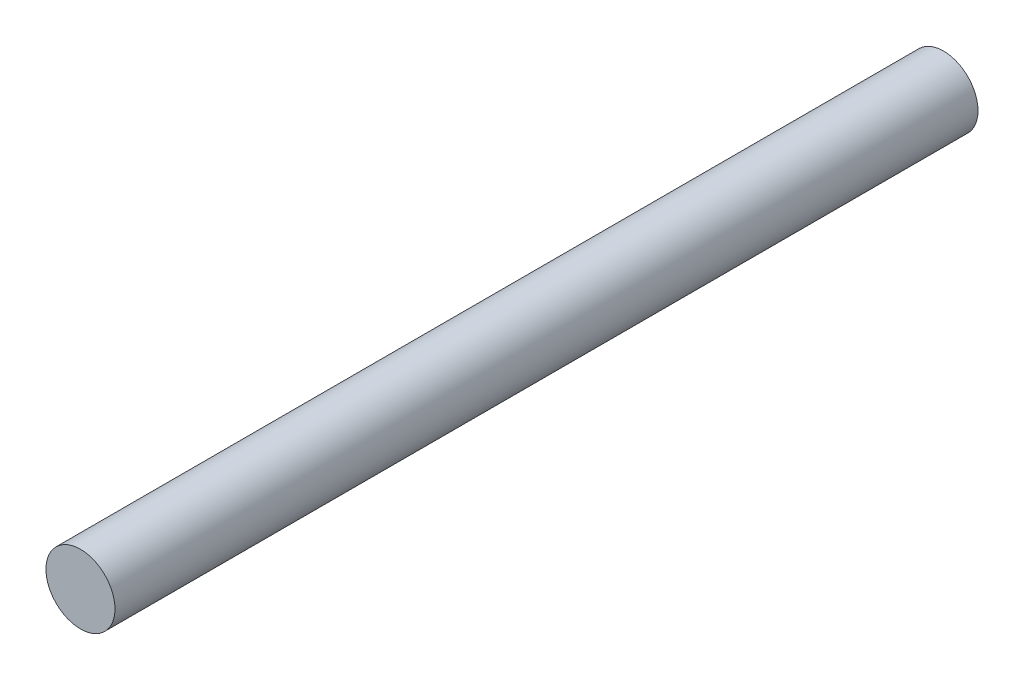
from build123d import *

# Parameters (mm, degrees)
SKETCH2_R           = 6
BOSS_EXTRUDE1_DEPTH = 150


with BuildPart() as part:
    # Sketch2 → Boss-Extrude1 (new body)
    with BuildSketch(Plane.XY):
        Circle(SKETCH2_R)
    extrude(amount=BOSS_EXTRUDE1_DEPTH)


solid = part.part
